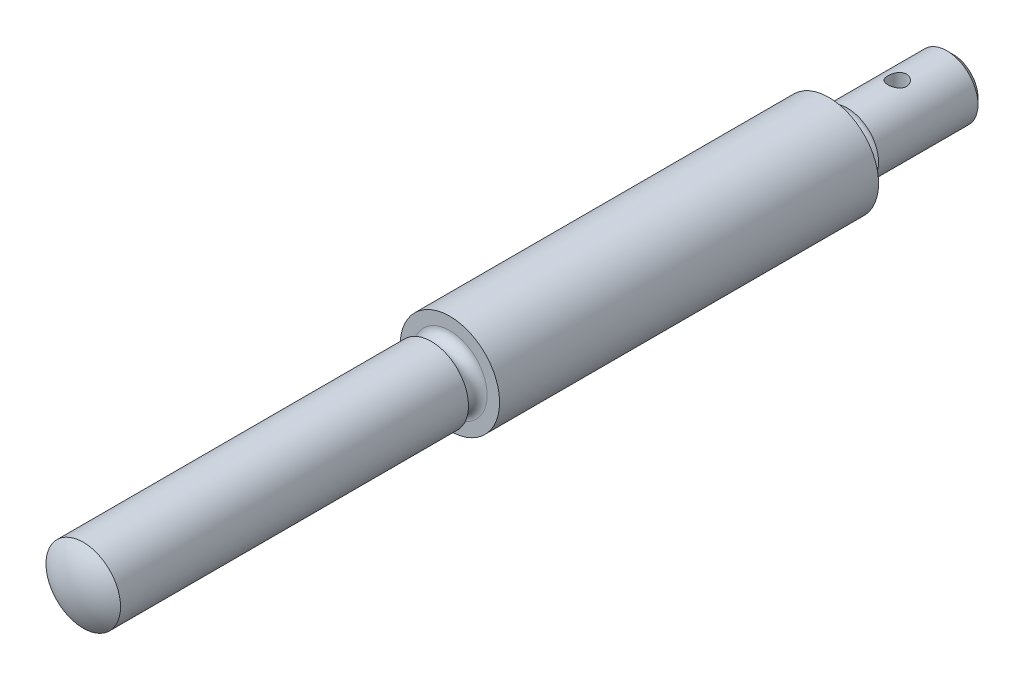
from build123d import *

# Parameters (mm, degrees)
SKETCH_2_R          = 1.5
CUT_EXTRUDE_1_DEPTH = 10
CHAMFER_1_SIZE      = 1


with BuildPart() as part:
    # 草圖1 → 旋轉1 (revolve)
    with BuildSketch(Plane(origin=(0, 0, 0), x_dir=(0, 0, -1), z_dir=(1, 0, 0)), mode=Mode.PRIVATE) as revolve_1_sk:
        with BuildLine():
            Line((2, 6), (58, 6))
            ThreePointArc((58, 6), (59.5, 4.5), (61, 6))
            Line((61, 6), (61, 8))
            Line((61, 8), (122, 8))
            Line((122, 8), (122, 5))
            ThreePointArc((122, 5), (123.5, 3.5), (125, 5))
            Line((125, 5), (142, 5))
            Line((142, 5), (142, 0))
            Line((142, 0), (0, 0))
            ThreePointArc((0, 0), (0.513167019, 3.16227766), (2, 6))
        make_face()
    revolve(revolve_1_sk.sketch.rotate(Axis((0, 0, 0), (0, 0, -1)), 90), axis=Axis((0, 0, 0), (0, 0, -1)))

    # 草圖2 → 除料-伸長1 (cut, symmetric)
    with BuildSketch(Plane(origin=(0, 0, 0), x_dir=(1, 0, 0), z_dir=(0, 1, 0))):
        with Locations(Location((0, 133, 0), (0, 0, 270))):
            Circle(SKETCH_2_R)
    extrude(amount=CUT_EXTRUDE_1_DEPTH, both=True, mode=Mode.SUBTRACT)

    # 導角1
    chamfer_1_edges = [part.edges().sort_by_distance(p)[0] for p in [
        (-5, 0, -142),
    ]]
    chamfer(chamfer_1_edges, length=CHAMFER_1_SIZE)


solid = part.part
